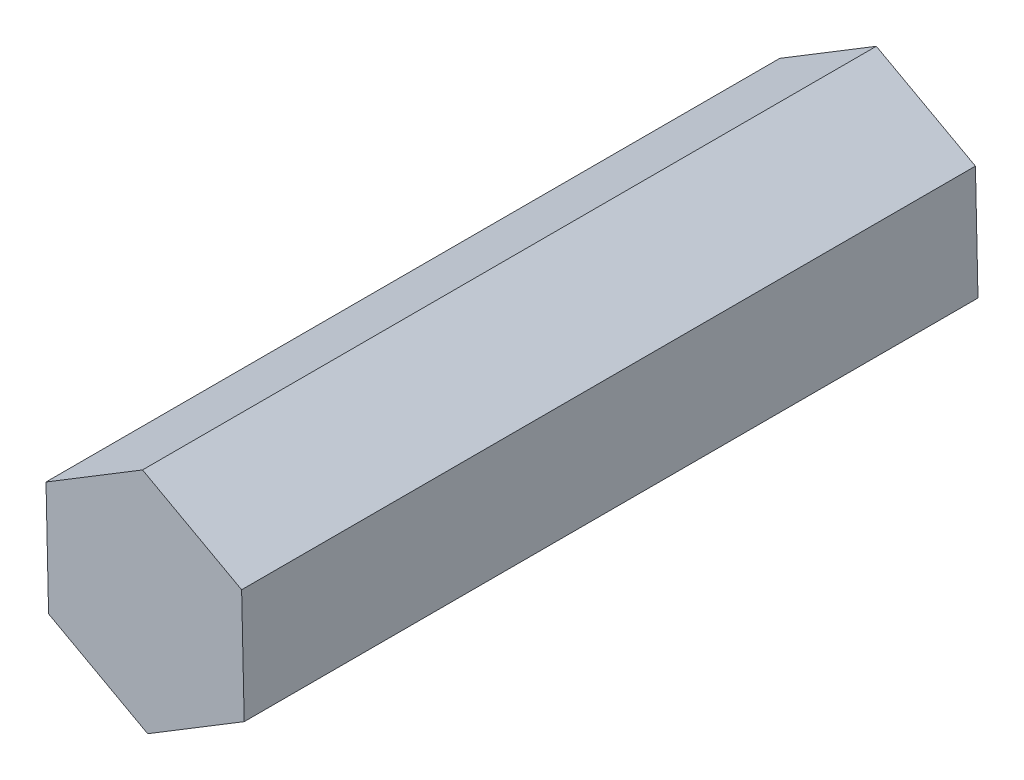
from build123d import *

# Parameters (mm, degrees)
BOSS_EXTRUDE1_DEPTH = 47.625


with BuildPart() as part:
    # Sketch1 → Boss-Extrude1 (new body)
    with BuildSketch(Plane.XY):
        Polygon((-6.432191201, 3.519978649), (-6.264486531, -3.810451657), (0.167704669, -7.330430306), (6.432191201, -3.519978649), (6.264486531, 3.810451657), (-0.167704669, 7.330430306), align=None)
    extrude(amount=BOSS_EXTRUDE1_DEPTH)


solid = part.part
